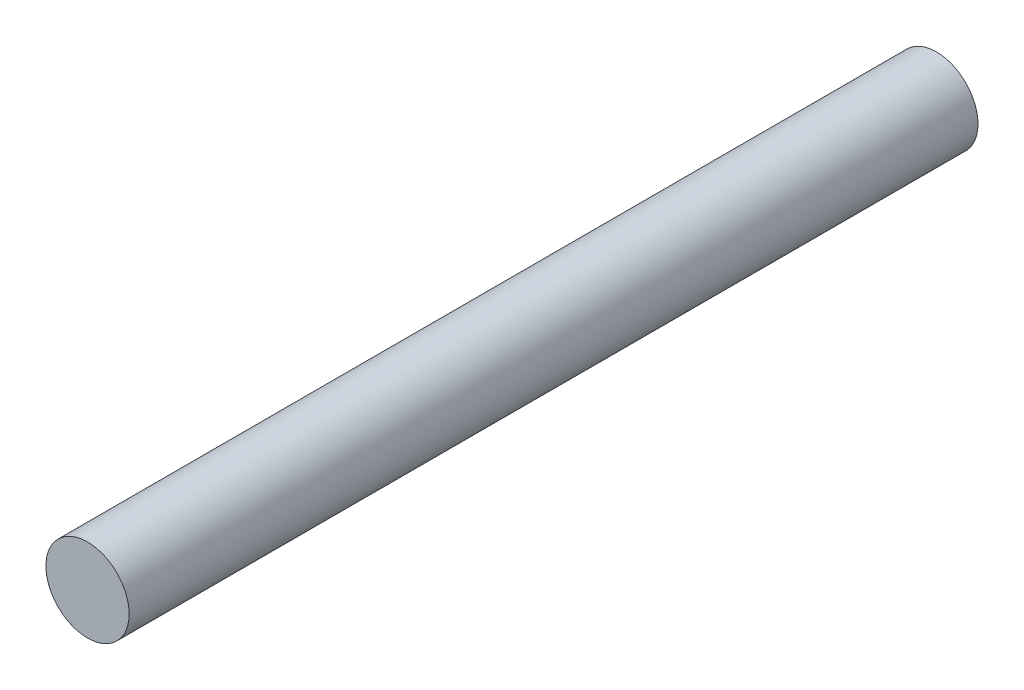
from build123d import *

# Parameters (mm, degrees)
SKETCH1_R           = 10
BOSS_EXTRUDE1_DEPTH = 204


with BuildPart() as part:
    # Sketch1 → Boss-Extrude1 (new body)
    with BuildSketch(Plane.XY):
        Circle(SKETCH1_R)
    extrude(amount=BOSS_EXTRUDE1_DEPTH)


solid = part.part
